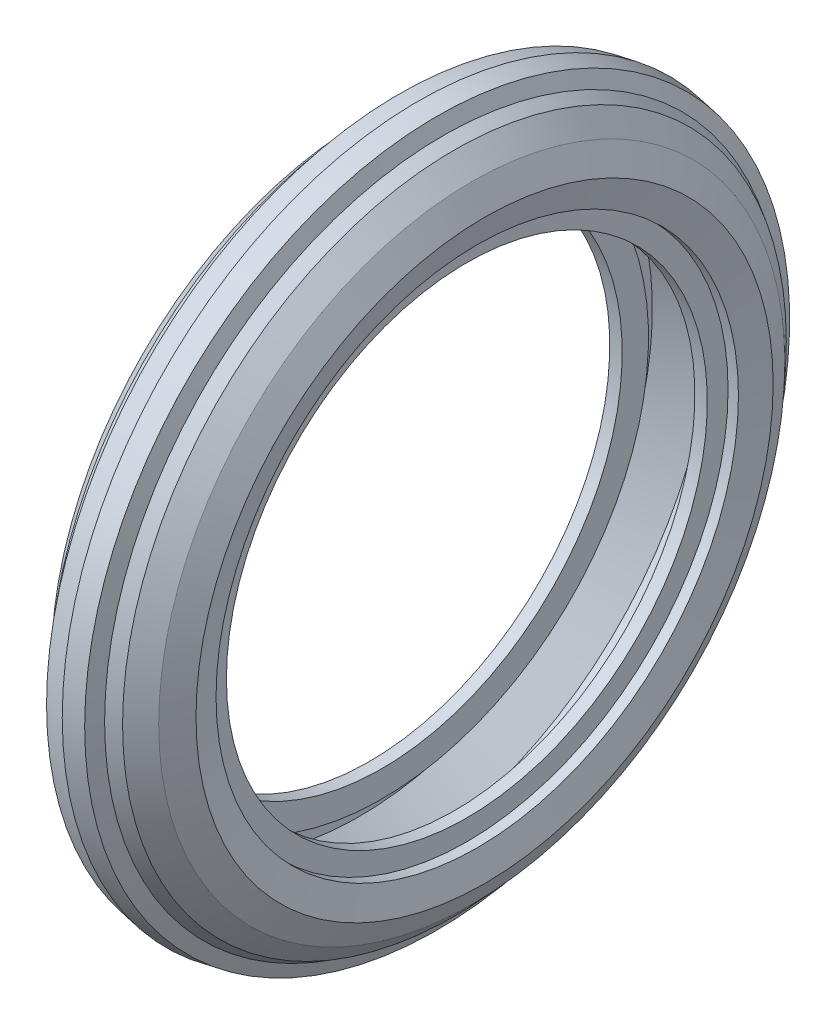
from build123d import *


with BuildPart() as part:
    # Front → Revolve1 (revolve)
    with BuildSketch(Plane.XY, mode=Mode.PRIVATE) as revolve1_sk:
        Polygon((0, 47.7), (4.04774101, 46.579378424), (8.49102763, 42.4), (8.49102763, 40.4), (5.258381655, 38.6), (5.258381655, 34.8), (7.058381655, 34.8), (7.058381655, 37.8), (8.558381655, 37.8), (9.619339829, 41.760349449), (7.760518893, 45.302211209), (5.258381655, 48.027887133), (3.61929083, 48.988814429), (2.757308273, 51.012915728), (0, 51.5), (-2.757308273, 51.012915728), (-3.61929083, 48.988814429), (-5.258381655, 48.027887133), (-7.760518893, 45.302211209), (-9.619339829, 41.760349449), (-8.558381655, 37.8), (-7.058381655, 37.8), (-7.058381655, 34.8), (-5.258381655, 34.8), (-5.258381655, 38.6), (-8.49102763, 40.4), (-8.49102763, 42.4), (-4.04774101, 46.579378424), align=None)
    revolve(revolve1_sk.sketch.rotate(Axis((0, 0, 0), (1, 0, 0)), 90), axis=Axis((0, 0, 0), (1, 0, 0)))


solid = part.part
